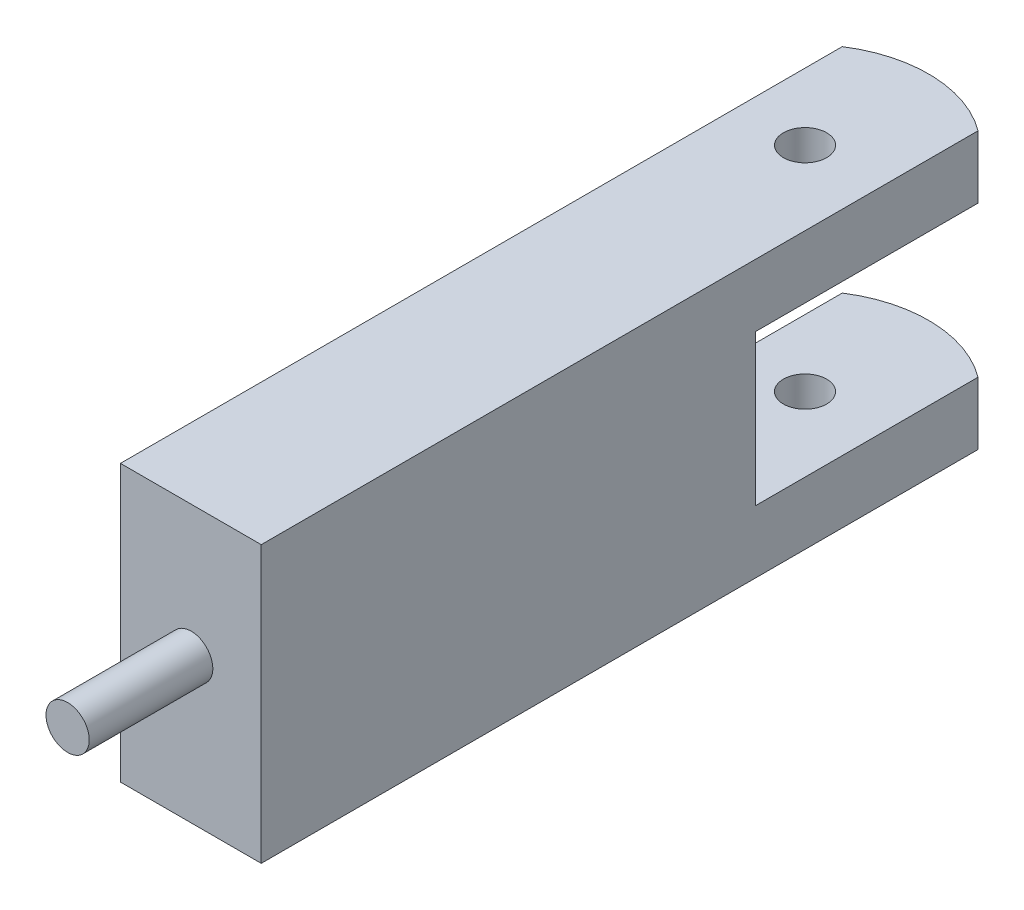
from build123d import *

# Parameters (mm, degrees)
SKETCH3_W            = 30
SKETCH3_H            = 30
BOSS_EXTRUDE1_DEPTH  = 40
CUT_EXTRUDE4_START   = -40
CUT_EXTRUDE4_DEPTH   = 99.309518948
MIRROR5_START        = -40
MIRROR5_COPY_1_DEPTH = 99.309518948
SKETCH9_R            = 1.75
BOSS_EXTRUDE2_DEPTH  = 30
CUT_EXTRUDE5_DEPTH   = 30
SKETCH11_W           = 20
SKETCH11_H           = 12.2
CUT_EXTRUDE6_DEPTH   = 44.5
SKETCH12_R           = 1.75
BOSS_EXTRUDE3_DEPTH  = 10
CUT_EXTRUDE13_DEPTH  = 67
SKETCH16_W           = 6.483229808
SKETCH16_H           = 22.339130026
SKETCH16_W_2         = 7.133382066
CUT_EXTRUDE14_DEPTH  = 67


with BuildPart() as part:
    # Sketch3 → Boss-Extrude1 (new body)
    with BuildSketch(Plane.XY):
        with Locations((15, 15)):
            Rectangle(SKETCH3_W, SKETCH3_H)
    extrude(amount=BOSS_EXTRUDE1_DEPTH)

    # Sketch8 → Cut-Extrude4 (cut)
    with BuildSketch(Plane(origin=(0, 0, 0), x_dir=(-1, 0, 0), z_dir=(0, 0, -1)).offset(CUT_EXTRUDE4_START)):
        Polygon((-77.236567429, -51.703622198), (-30, 17.572977849), (-21.526577959, 30), (25.70998947, 99.276600047), (-112.843210625, 193.749734905), (-215.789767524, 42.769512659), align=None)
    cut_extrude4 = extrude(amount=CUT_EXTRUDE4_DEPTH, mode=Mode.SUBTRACT)

    # Mirror4: Cut-Extrude4 across plane
    add(cut_extrude4.mirror(Plane.ZY.offset(-15)), mode=Mode.SUBTRACT)

    # Mirror5: Cut-Extrude4 across plane
    add(cut_extrude4.mirror(Plane(origin=(0, 15, 0), x_dir=(0, 0, 1), z_dir=(0, -1, 0))), mode=Mode.SUBTRACT)

    # Mirror5 copy 1 sketch → Mirror5 copy 1 (cut)
    with BuildSketch(Plane(origin=(30, 30, 0), x_dir=(1, 0, 0), z_dir=(0, 0, -1)).offset(MIRROR5_START)):
        Polygon((-77.236567429, -51.703622198), (-30, 17.572977849), (-21.526577959, 30), (25.70998947, 99.276600047), (-112.843210625, 193.749734905), (-215.789767524, 42.769512659), align=None)
    extrude(amount=MIRROR5_COPY_1_DEPTH, mode=Mode.SUBTRACT)

    # Sketch9 → Boss-Extrude2 (add)
    with BuildSketch(Plane(origin=(0, 0, 0), x_dir=(1, 0, 0), z_dir=(0, 1, 0))):
        with BuildLine():
            Line((5.769230769, 13.846153846), (0, 0))
            Line((0, 0), (30, 0))
            Line((30, 0), (24.924823528, 11.223878236))
            Line((24.924823528, 11.223878236), (22.474176558, 16.643544594))
            ThreePointArc((22.474176558, 16.643544594), (13.348408887, 19.862669355), (5.769230769, 13.846153846))
        make_face()
        with Locations(Location((15, 10, 0), (0, 0, 270))):
            Circle(SKETCH9_R, mode=Mode.SUBTRACT)
    extrude(amount=BOSS_EXTRUDE2_DEPTH)

    # Sketch10 → Cut-Extrude5 (cut)
    with BuildSketch(Plane.XY):
        Polygon((0, 17.572977849), (8.473422041, 30), (0, 30), align=None)
        Polygon((8.473422041, 0), (0, 0), (0, 12.427022151), align=None)
        Polygon((21.526577959, 0), (30, 12.427022151), (30, 0), align=None)
        Polygon((30, 17.572977849), (21.526577959, 30), (30, 30), align=None)
    extrude(amount=-CUT_EXTRUDE5_DEPTH, mode=Mode.SUBTRACT)

    # Sketch11 → Cut-Extrude6 (cut, symmetric)
    with BuildSketch(Plane(origin=(30, 0, 0), x_dir=(0, 0, -1), z_dir=(1, 0, 0))):
        with Locations((10, 15)):
            Rectangle(SKETCH11_W, SKETCH11_H)
    extrude(amount=CUT_EXTRUDE6_DEPTH, both=True, mode=Mode.SUBTRACT)

    # Sketch12 → Boss-Extrude3 (add)
    with BuildSketch(Plane.XY.offset(40)):
        with Locations(Location((15.321801173, 15.520127928, 0), (0, 0, 180))):
            Circle(SKETCH12_R)
    extrude(amount=BOSS_EXTRUDE3_DEPTH)

    # Sketch15 → Cut-Extrude13 (cut)
    with BuildSketch(Plane.XY.offset(40)):
        Polygon((8.473422041, 30), (5.86162238, 26.169565013), (24.13837762, 26.169565013), (21.526577959, 30), align=None)
        Polygon((30, 17.572977849), (24.220848208, 26.048614609), (24.220848208, 15), (30, 15), align=None)
        Polygon((30, 15), (24.220848208, 15), (24.220848208, 3.951385391), (30, 12.427022151), align=None)
        Polygon((24.13837762, 3.830434987), (5.86162238, 3.830434987), (8.473422041, 0), (21.526577959, 0), align=None)
        Polygon((5.769230769, 3.965935447), (5.815144659, 15), (0, 15), (0, 12.427022151), align=None)
        Polygon((5.815144659, 15), (5.86162238, 26.169565013), (0, 17.572977849), (0, 15), align=None)
    extrude(amount=-CUT_EXTRUDE13_DEPTH, mode=Mode.SUBTRACT)

    # Sketch16 → Cut-Extrude14 (cut)
    with BuildSketch(Plane.XY.offset(40)):
        with Locations((6.355269315, 15)):
            Rectangle(SKETCH16_W, SKETCH16_H)
        with Locations((24.558031714, 15)):
            Rectangle(SKETCH16_W_2, SKETCH16_H)
    extrude(amount=-CUT_EXTRUDE14_DEPTH, mode=Mode.SUBTRACT)


solid = part.part
